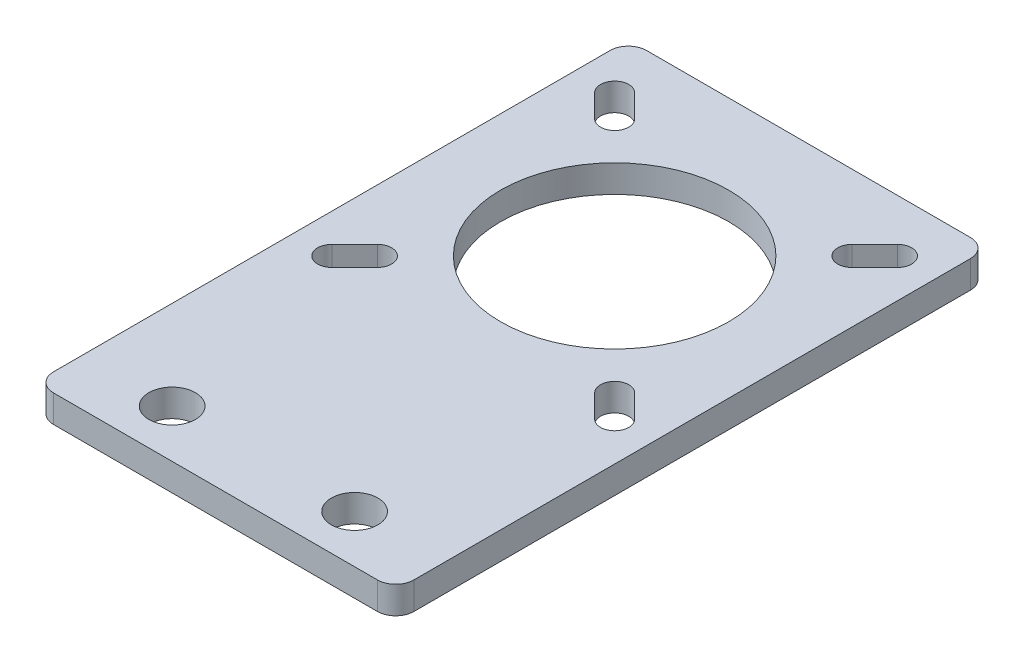
from build123d import *

# Parameters (mm, degrees)
SKETCH1_R           = 12.5
SKETCH1_R_2         = 2.55
BOSS_EXTRUDE1_DEPTH = 3


with BuildPart() as part:
    # Sketch1 → Boss-Extrude1 (new body)
    with BuildSketch(Plane(origin=(0, 0, 0), x_dir=(1, 0, 0), z_dir=(0, 1, 0))):
        with BuildLine():
            Line((17.75, -43.75), (-17.75, -43.75))
            ThreePointArc((-17.75, -43.75), (-19.164213562, -43.164213562), (-19.75, -41.75))
            Line((-19.75, -41.75), (-19.75, 19.25))
            ThreePointArc((-19.75, 19.25), (-19.164213562, 20.664213562), (-17.75, 21.25))
            Line((-17.75, 21.25), (17.75, 21.25))
            ThreePointArc((17.75, 21.25), (19.164213562, 20.664213562), (19.75, 19.25))
            Line((19.75, 19.25), (19.75, -41.75))
            ThreePointArc((19.75, -41.75), (19.164213562, -43.164213562), (17.75, -43.75))
        make_face()
        with Locations(Location((0, 0, 0), (0, 0, 270))):
            Circle(SKETCH1_R, mode=Mode.SUBTRACT)
        with Locations(Location((10, -38.5, 0), (0, 0, 270))):
            Circle(SKETCH1_R_2, mode=Mode.SUBTRACT)
        with Locations(Location((-10, -38.5, 0), (0, 0, 270))):
            Circle(SKETCH1_R_2, mode=Mode.SUBTRACT)
        with BuildLine():
            Line((11.903984489, 14.096015511), (14.403984489, 16.596015511))
            ThreePointArc((14.403984489, 16.596015511), (16.596015511, 16.596015511), (16.596015511, 14.403984489))
            Line((16.596015511, 14.403984489), (14.096015511, 11.903984489))
            ThreePointArc((14.096015511, 11.903984489), (11.903984489, 11.903984489), (11.903984489, 14.096015511))
        make_face(mode=Mode.SUBTRACT)
        with BuildLine():
            Line((-11.903984489, 14.096015511), (-14.403984489, 16.596015511))
            ThreePointArc((-14.403984489, 16.596015511), (-16.596015511, 16.596015511), (-16.596015511, 14.403984489))
            Line((-16.596015511, 14.403984489), (-14.096015511, 11.903984489))
            ThreePointArc((-14.096015511, 11.903984489), (-11.903984489, 11.903984489), (-11.903984489, 14.096015511))
        make_face(mode=Mode.SUBTRACT)
        with BuildLine():
            Line((-11.903984489, -14.096015511), (-14.403984489, -16.596015511))
            ThreePointArc((-14.403984489, -16.596015511), (-16.596015511, -16.596015511), (-16.596015511, -14.403984489))
            Line((-16.596015511, -14.403984489), (-14.096015511, -11.903984489))
            ThreePointArc((-14.096015511, -11.903984489), (-11.903984489, -11.903984489), (-11.903984489, -14.096015511))
        make_face(mode=Mode.SUBTRACT)
        with BuildLine():
            Line((11.903984489, -14.096015511), (14.403984489, -16.596015511))
            ThreePointArc((14.403984489, -16.596015511), (16.596015511, -16.596015511), (16.596015511, -14.403984489))
            Line((16.596015511, -14.403984489), (14.096015511, -11.903984489))
            ThreePointArc((14.096015511, -11.903984489), (11.903984489, -11.903984489), (11.903984489, -14.096015511))
        make_face(mode=Mode.SUBTRACT)
    extrude(amount=BOSS_EXTRUDE1_DEPTH)


solid = part.part
